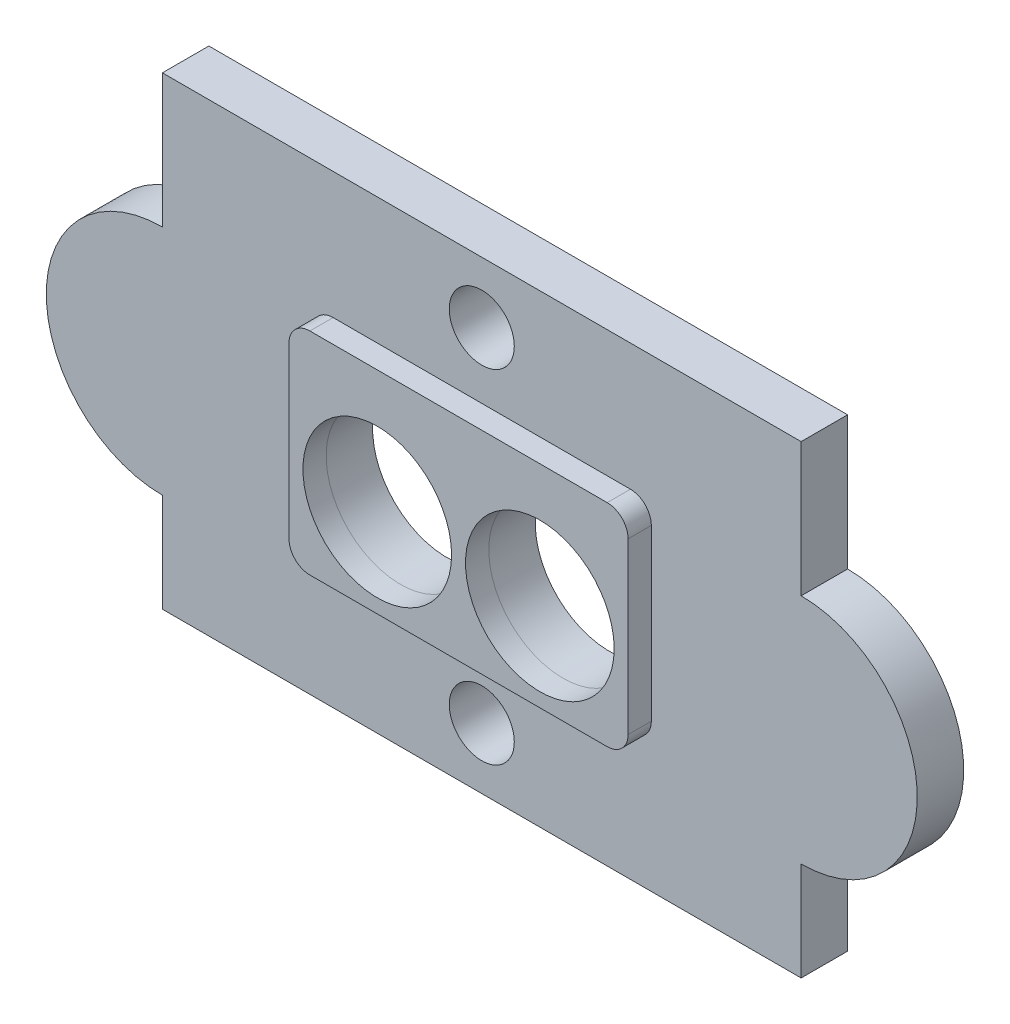
from build123d import *

# Parameters (mm, degrees)
BOSS_EXTRUDE1_DEPTH = 1
BOSS_EXTRUDE2_DEPTH = 2
SKETCH3_R           = 1.4
CUT_EXTRUDE1_DEPTH  = 22.343910138
FILLET1_R           = 0.9


with BuildPart() as part:
    # Sketch1 → Boss-Extrude1 (new body)
    with BuildSketch(Plane.XY):
        with BuildLine():
            Line((-7.3, 4.55), (-7.3, -0.75))
            Line((-7.3, -0.75), (-6.7, -0.75))
            ThreePointArc((-6.7, -0.75), (-3.5, 2.45), (-0.3, -0.75))
            Line((-0.3, -0.75), (0.3, -0.75))
            ThreePointArc((0.3, -0.75), (3.5, 2.45), (6.7, -0.75))
            Line((6.7, -0.75), (7.3, -0.75))
            Line((7.3, -0.75), (7.3, 4.55))
            Line((7.3, 4.55), (-7.3, 4.55))
        make_face()
        with BuildLine():
            Line((-6.7, -0.75), (-7.3, -0.75))
            Line((-7.3, -0.75), (-7.3, -4.55))
            Line((-7.3, -4.55), (7.3, -4.55))
            Line((7.3, -4.55), (7.3, -0.75))
            Line((7.3, -0.75), (6.7, -0.75))
            ThreePointArc((6.7, -0.75), (3.5, -3.95), (0.3, -0.75))
            Line((0.3, -0.75), (-0.3, -0.75))
            ThreePointArc((-0.3, -0.75), (-3.5, -3.95), (-6.7, -0.75))
        make_face()
    extrude(amount=BOSS_EXTRUDE1_DEPTH)

    # Fillet1
    fillet1_edges = [part.edges().sort_by_distance(p)[0] for p in [
        (-7.3, -4.55, 0.5),
        (-7.3, 4.55, 0.5),
        (7.3, 4.55, 0.5),
        (7.3, -4.55, 0.5),
    ]]
    fillet(fillet1_edges, radius=FILLET1_R)


with BuildPart() as body_2:
    # Sketch2 → Boss-Extrude2 (new body)
    with BuildSketch(Plane.XY):
        with BuildLine():
            Line((-13.75, -5.75), (-13.75, -0.75))
            Line((-13.75, -0.75), (-13.75, 4.25))
            ThreePointArc((-13.75, 4.25), (-18.75, -0.75), (-13.75, -5.75))
        make_face()
        with BuildLine():
            ThreePointArc((13.75, -5.75), (18.75, -0.75), (13.75, 4.25))
            Line((13.75, 4.25), (13.75, -0.75))
            Line((13.75, -0.75), (13.75, -5.75))
        make_face()
        Polygon((-7.5, -0.75), (-13.75, -0.75), (-13.75, -5.75), (-13.75, -10), (0, -10), (0, -4.75), (-7.5, -4.75), align=None)
        Polygon((7.5, -4.75), (0, -4.75), (0, -10), (13.75, -10), (13.75, -5.75), (13.75, -0.75), (7.5, -0.75), align=None)
        Polygon((-13.75, 4.25), (-13.75, -0.75), (-7.5, -0.75), (-7.5, 4.75), (0, 4.75), (0, 10), (-13.75, 10), align=None)
        Polygon((0, 10), (0, 4.75), (7.5, 4.75), (7.5, -0.75), (13.75, -0.75), (13.75, 4.25), (13.75, 10), align=None)
        with BuildLine():
            Line((-7.3, 4.55), (-7.3, -0.75))
            Line((-7.3, -0.75), (-6.7, -0.75))
            ThreePointArc((-6.7, -0.75), (-3.5, 2.45), (-0.3, -0.75))
            Line((-0.3, -0.75), (0, -0.75))
            Line((0, -0.75), (0, 4.55))
            Line((0, 4.55), (-7.3, 4.55))
        make_face()
        with BuildLine():
            Line((7.3, 4.55), (0, 4.55))
            Line((0, 4.55), (0, -0.75))
            Line((0, -0.75), (0.3, -0.75))
            ThreePointArc((0.3, -0.75), (3.5, 2.45), (6.7, -0.75))
            Line((6.7, -0.75), (7.3, -0.75))
            Line((7.3, -0.75), (7.3, 4.55))
        make_face()
        with BuildLine():
            Line((0, -0.75), (0, -4.55))
            Line((0, -4.55), (7.3, -4.55))
            Line((7.3, -4.55), (7.3, -0.75))
            Line((7.3, -0.75), (6.7, -0.75))
            ThreePointArc((6.7, -0.75), (3.5, -3.95), (0.3, -0.75))
            Line((0.3, -0.75), (0, -0.75))
        make_face()
        with BuildLine():
            Line((-6.7, -0.75), (-7.3, -0.75))
            Line((-7.3, -0.75), (-7.3, -4.55))
            Line((-7.3, -4.55), (0, -4.55))
            Line((0, -4.55), (0, -0.75))
            Line((0, -0.75), (-0.3, -0.75))
            ThreePointArc((-0.3, -0.75), (-3.5, -3.95), (-6.7, -0.75))
        make_face()
        Polygon((-7.3, -0.75), (-7.5, -0.75), (-7.5, -4.75), (0, -4.75), (0, -4.55), (-7.3, -4.55), align=None)
        Polygon((0, -4.55), (0, -4.75), (7.5, -4.75), (7.5, -0.75), (7.3, -0.75), (7.3, -4.55), align=None)
        Polygon((-7.5, 4.75), (-7.5, -0.75), (-7.3, -0.75), (-7.3, 4.55), (0, 4.55), (0, 4.75), align=None)
        Polygon((7.5, 4.75), (0, 4.75), (0, 4.55), (7.3, 4.55), (7.3, -0.75), (7.5, -0.75), align=None)
    extrude(amount=-BOSS_EXTRUDE2_DEPTH)

    # Sketch3 → Cut-Extrude1 (cut, through all)
    with BuildSketch(Plane.XY):
        with BuildLine():
            ThreePointArc((1.4, 7.375), (0.989949494, 8.364949494), (0, 8.775))
            Line((0, 8.775), (0, 5.975))
            ThreePointArc((0, 5.975), (0.989949494, 6.385050506), (1.4, 7.375))
        make_face()
        with BuildLine():
            Line((0, 5.975), (0, 8.775))
            ThreePointArc((0, 8.775), (-1.4, 7.375), (0, 5.975))
        make_face()
        with Locations((0, -7.375)):
            Circle(SKETCH3_R)
    extrude(amount=-CUT_EXTRUDE1_DEPTH, mode=Mode.SUBTRACT)


solid = Compound([part.part, body_2.part])
